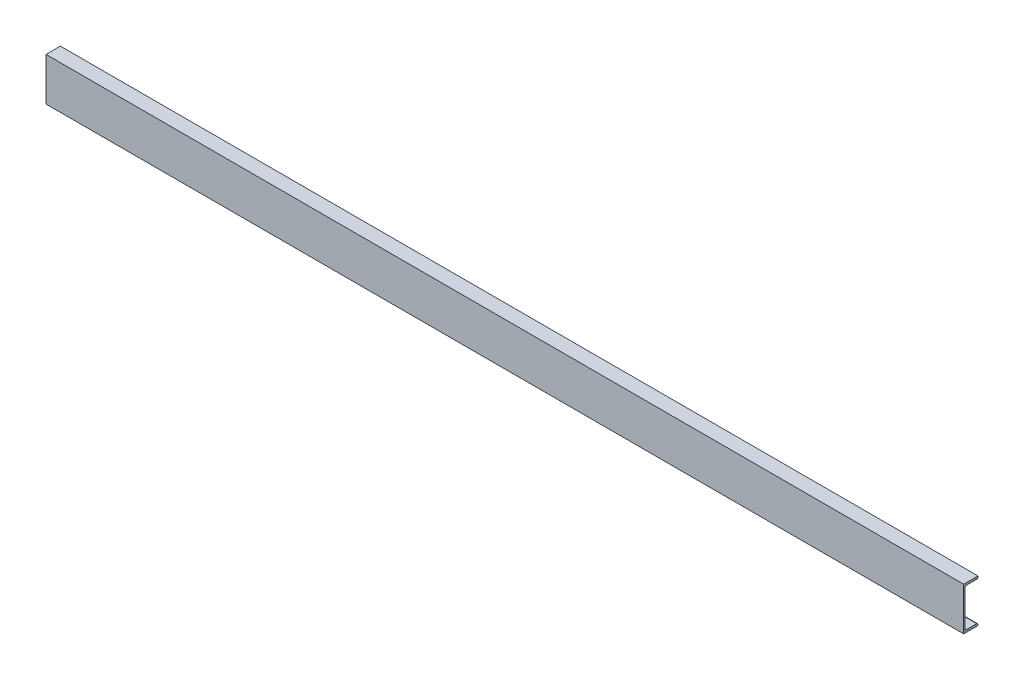
from build123d import *

# Parameters (mm, degrees)
BOSS_EXTRUDE1_DEPTH = 6400


with BuildPart() as part:
    # Sketch1 → Boss-Extrude1 (new body)
    with BuildSketch(Plane(origin=(0, 0, 0), x_dir=(0, 0, -1), z_dir=(1, 0, 0))):
        with BuildLine():
            Line((-86.622073579, 113.879598662), (-186.622073579, 113.879598662))
            Line((-186.622073579, 113.879598662), (-186.622073579, -186.120401338))
            Line((-186.622073579, -186.120401338), (-86.622073579, -186.120401338))
            Line((-86.622073579, -186.120401338), (-86.622073579, -180.120401338))
            ThreePointArc((-86.622073579, -180.120401338), (-89.551005767, -173.049333526), (-96.622073579, -170.120401338))
            Line((-96.622073579, -170.120401338), (-166.622073579, -170.120401338))
            ThreePointArc((-166.622073579, -170.120401338), (-173.69314139, -167.19146915), (-176.622073579, -160.120401338))
            Line((-176.622073579, -160.120401338), (-176.622073579, 87.879598662))
            ThreePointArc((-176.622073579, 87.879598662), (-173.69314139, 94.950666474), (-166.622073579, 97.879598662))
            Line((-166.622073579, 97.879598662), (-96.622073579, 97.879598662))
            ThreePointArc((-96.622073579, 97.879598662), (-89.551005767, 100.80853085), (-86.622073579, 107.879598662))
            Line((-86.622073579, 107.879598662), (-86.622073579, 113.879598662))
        make_face()
    extrude(amount=BOSS_EXTRUDE1_DEPTH)


solid = part.part
